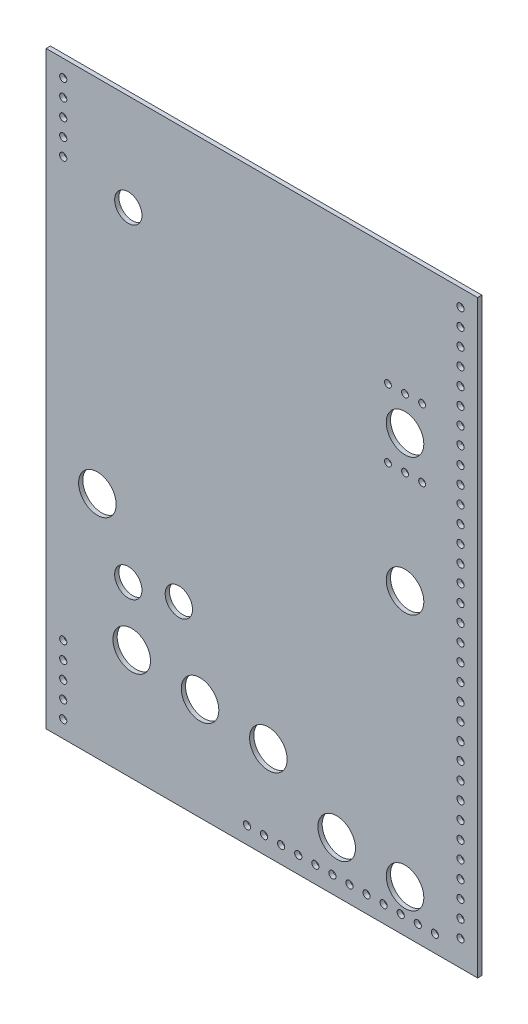
from build123d import *

# Parameters (mm, degrees)
SKETCH1_W           = 320.802
SKETCH1_H           = 438.15
BOSS_EXTRUDE1_DEPTH = 3.175
SKETCH2_R           = 13.97
SKETCH2_R_2         = 2.54
CUT_EXTRUDE1_DEPTH  = 3.175
SKETCH3_R           = 10.16
CUT_EXTRUDE3_DEPTH  = 3.175
SKETCH4_R           = 2.667
CUT_EXTRUDE4_DEPTH  = 3.175
SKETCH5_R           = 13.97
CUT_EXTRUDE5_DEPTH  = 3.175


with BuildPart() as part:
    # Sketch1 → Boss-Extrude1 (new body)
    with BuildSketch(Plane.XY):
        Rectangle(SKETCH1_W, SKETCH1_H)
    extrude(amount=BOSS_EXTRUDE1_DEPTH)

    # Sketch2 → Cut-Extrude1 (cut)
    with BuildSketch(Plane.XY.offset(3.175)):
        with Locations((106.445821197, -187.325)):
            Circle(SKETCH2_R)
        with Locations((55.626, -180.975)):
            Circle(SKETCH2_R)
        with Locations((4.826, -149.225)):
            Circle(SKETCH2_R)
        with Locations((-45.974, -142.875)):
            Circle(SKETCH2_R)
        with Locations((-96.774, -136.525)):
            Circle(SKETCH2_R)
        with Locations((106.445821197, 3.175)):
            Circle(SKETCH2_R)
        with Locations((106.445821197, 104.775)):
            Circle(SKETCH2_R)
        with Locations((93.745821197, 130.175)):
            Circle(SKETCH2_R_2)
        with Locations((106.445821197, 130.175)):
            Circle(SKETCH2_R_2)
        with Locations((119.145821197, 130.175)):
            Circle(SKETCH2_R_2)
        with Locations((93.745821197, 79.375)):
            Circle(SKETCH2_R_2)
        with Locations((106.445821197, 79.375)):
            Circle(SKETCH2_R_2)
        with Locations((119.145821197, 79.375)):
            Circle(SKETCH2_R_2)
    extrude(amount=-CUT_EXTRUDE1_DEPTH, mode=Mode.SUBTRACT)

    # Sketch3 → Cut-Extrude3 (cut)
    with BuildSketch(Plane.XY.offset(3.175)):
        with Locations((-99.314, 147.193)):
            Circle(SKETCH3_R)
        with Locations((-61.722, -87.757)):
            Circle(SKETCH3_R)
        with Locations((-99.314, -94.107)):
            Circle(SKETCH3_R)
    extrude(amount=-CUT_EXTRUDE3_DEPTH, mode=Mode.SUBTRACT)

    # Sketch4 → Cut-Extrude4 (cut)
    with BuildSketch(Plane.XY.offset(3.175)):
        with Locations((-147.701, -206.481352377)):
            Circle(SKETCH4_R)
        with Locations((-147.701, -193.781352377)):
            Circle(SKETCH4_R)
        with Locations((-147.701, -181.081352377)):
            Circle(SKETCH4_R)
        with Locations((-147.701, -168.381352377)):
            Circle(SKETCH4_R)
        with Locations((-147.701, -155.681352377)):
            Circle(SKETCH4_R)
        with Locations(Location((-147.701, 206.481352377, 0), (0, 0, 180))):
            Circle(SKETCH4_R)
        with Locations(Location((-147.701, 193.781352377, 0), (0, 0, 180))):
            Circle(SKETCH4_R)
        with Locations(Location((-147.701, 181.081352377, 0), (0, 0, 180))):
            Circle(SKETCH4_R)
        with Locations(Location((-147.701, 168.381352377, 0), (0, 0, 180))):
            Circle(SKETCH4_R)
        with Locations(Location((-147.701, 155.681352377, 0), (0, 0, 180))):
            Circle(SKETCH4_R)
        with Locations((147.701, 155.681352377)):
            Circle(SKETCH4_R)
        with Locations((147.701, 168.381352377)):
            Circle(SKETCH4_R)
        with Locations((147.701, 181.081352377)):
            Circle(SKETCH4_R)
        with Locations((147.701, 193.781352377)):
            Circle(SKETCH4_R)
        with Locations((147.701, 206.481352377)):
            Circle(SKETCH4_R)
        with Locations((147.701, 142.981352377)):
            Circle(SKETCH4_R)
        with Locations((147.701, 130.281352377)):
            Circle(SKETCH4_R)
        with Locations((147.701, 117.581352377)):
            Circle(SKETCH4_R)
        with Locations((147.701, 104.881352377)):
            Circle(SKETCH4_R)
        with Locations((147.701, 92.181352377)):
            Circle(SKETCH4_R)
        with Locations((147.701, 79.481352377)):
            Circle(SKETCH4_R)
        with Locations((147.701, 66.781352377)):
            Circle(SKETCH4_R)
        with Locations((147.701, 54.081352377)):
            Circle(SKETCH4_R)
        with Locations((147.701, 41.381352377)):
            Circle(SKETCH4_R)
        with Locations((147.701, 28.681352377)):
            Circle(SKETCH4_R)
        with Locations((147.701, 15.981352377)):
            Circle(SKETCH4_R)
        with Locations((147.701, 3.281352377)):
            Circle(SKETCH4_R)
        with Locations((147.701, -9.418647623)):
            Circle(SKETCH4_R)
        with Locations((147.701, -22.118647623)):
            Circle(SKETCH4_R)
        with Locations((147.701, -34.818647623)):
            Circle(SKETCH4_R)
        with Locations((147.701, -47.518647623)):
            Circle(SKETCH4_R)
        with Locations((147.701, -60.218647623)):
            Circle(SKETCH4_R)
        with Locations((147.701, -72.918647623)):
            Circle(SKETCH4_R)
        with Locations((147.701, -85.618647623)):
            Circle(SKETCH4_R)
        with Locations((147.701, -98.318647623)):
            Circle(SKETCH4_R)
        with Locations((147.701, -111.018647623)):
            Circle(SKETCH4_R)
        with Locations((147.701, -123.718647623)):
            Circle(SKETCH4_R)
        with Locations((147.701, -136.418647623)):
            Circle(SKETCH4_R)
        with Locations((147.701, -149.118647623)):
            Circle(SKETCH4_R)
        with Locations((147.701, -161.818647623)):
            Circle(SKETCH4_R)
        with Locations((147.701, -174.518647623)):
            Circle(SKETCH4_R)
        with Locations((147.701, -187.218647623)):
            Circle(SKETCH4_R)
        with Locations((147.701, -199.918647623)):
            Circle(SKETCH4_R)
        with Locations(Location((103.251, -206.481352377, 0), (0, 0, 180))):
            Circle(SKETCH4_R)
        with Locations(Location((115.951, -206.481352377, 0), (0, 0, 180))):
            Circle(SKETCH4_R)
        with Locations(Location((128.651, -206.481352377, 0), (0, 0, 180))):
            Circle(SKETCH4_R)
        with Locations(Location((90.551, -206.481352377, 0), (0, 0, 180))):
            Circle(SKETCH4_R)
        with Locations(Location((65.151, -206.481352377, 0), (0, 0, 180))):
            Circle(SKETCH4_R)
        with Locations(Location((77.851, -206.481352377, 0), (0, 0, 180))):
            Circle(SKETCH4_R)
        with Locations(Location((52.451, -206.481352377, 0), (0, 0, 180))):
            Circle(SKETCH4_R)
        with Locations(Location((39.751, -206.481352377, 0), (0, 0, 180))):
            Circle(SKETCH4_R)
        with Locations(Location((27.051, -206.481352377, 0), (0, 0, 180))):
            Circle(SKETCH4_R)
        with Locations(Location((14.351, -206.481352377, 0), (0, 0, 180))):
            Circle(SKETCH4_R)
        with Locations(Location((1.651, -206.481352377, 0), (0, 0, 180))):
            Circle(SKETCH4_R)
        with Locations(Location((-11.049, -206.481352377, 0), (0, 0, 180))):
            Circle(SKETCH4_R)
    extrude(amount=-CUT_EXTRUDE4_DEPTH, mode=Mode.SUBTRACT)

    # Sketch5 → Cut-Extrude5 (cut)
    with BuildSketch(Plane.XY.offset(3.175)):
        with Locations((-122.301, -48.514)):
            Circle(SKETCH5_R)
    extrude(amount=-CUT_EXTRUDE5_DEPTH, mode=Mode.SUBTRACT)


solid = part.part
